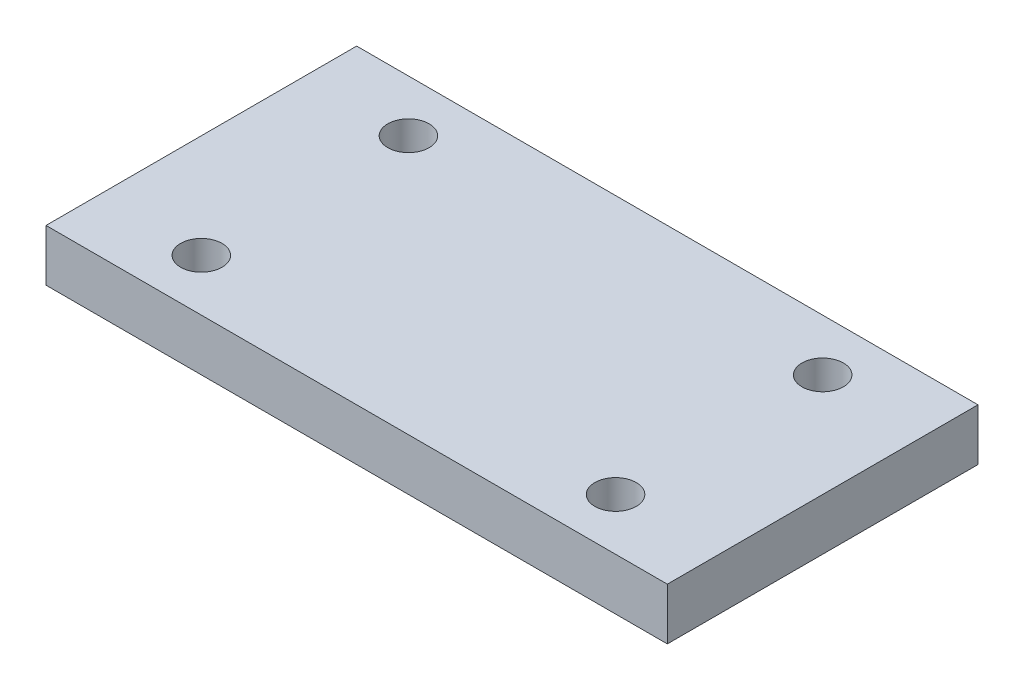
from build123d import *

# Parameters (mm, degrees)
SKETCH_1_W      = 60
SKETCH_1_H      = 30
SKETCH_1_R      = 2
EXTRUDE_1_DEPTH = 5


with BuildPart() as part:
    # 草图1 → 凸台-拉伸1 (new body)
    with BuildSketch(Plane(origin=(0, 0, 0), x_dir=(1, 0, 0), z_dir=(0, 1, 0))):
        Rectangle(SKETCH_1_W, SKETCH_1_H)
        with Locations(Location((-20, 10, 0), (0, 0, 270))):
            Circle(SKETCH_1_R, mode=Mode.SUBTRACT)
        with Locations(Location((20, 10, 0), (0, 0, 270))):
            Circle(SKETCH_1_R, mode=Mode.SUBTRACT)
        with Locations(Location((-20, -10, 0), (0, 0, 270))):
            Circle(SKETCH_1_R, mode=Mode.SUBTRACT)
        with Locations(Location((20, -10, 0), (0, 0, 270))):
            Circle(SKETCH_1_R, mode=Mode.SUBTRACT)
    extrude(amount=EXTRUDE_1_DEPTH)


solid = part.part
